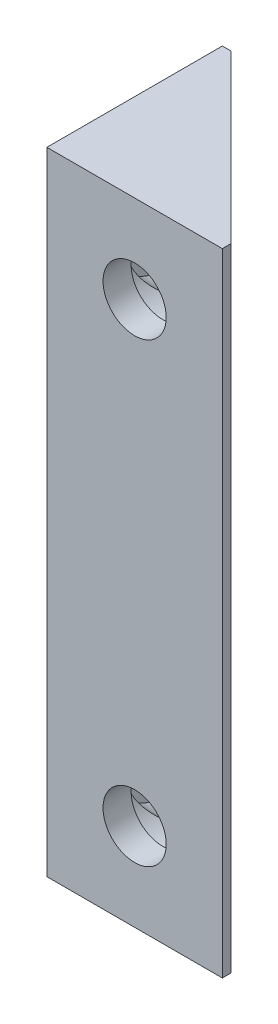
from build123d import *

# Parameters (mm, degrees)
BOSS_EXTRUDE1_DEPTH = 36
CUT_EXTRUDE1_REACH  = 47.782
SKETCH3_R           = 3.6
CUT_EXTRUDE3_REACH  = 50.982
CUT_EXTRUDE3_START  = -3.2
SKETCH3_4_R         = 5.5
SKETCH3_4_R_2       = 3.6
CUT_EXTRUDE2_REACH  = 47.782
SKETCH4_R           = 3.6
CUT_EXTRUDE4_REACH  = 50.982
CUT_EXTRUDE4_START  = -3.2
SKETCH4_3_R         = 5.5
SKETCH4_3_R_2       = 3.6


with BuildPart() as part:
    # Sketch2 → Boss-Extrude1 (new, symmetric)
    with BuildSketch(Plane(origin=(0, 0, 0), x_dir=(1, 0, 0), z_dir=(0, 1, 0))):
        Polygon((0, 0), (0, 20), (1, 20), (20, 1), (20, 0), align=None)
    extrude(amount=BOSS_EXTRUDE1_DEPTH, both=True)

    # Cut-Extrude1: up to this plane
    cut_extrude1_end = Plane(origin=(1, 36, -20), z_dir=(-0.7071067811865476, 0, 0.7071067811865476))
    # Sketch3 → Cut-Extrude1 (cut, up to the surface)
    with BuildSketch(Plane.XY, mode=Mode.PRIVATE) as cut_extrude1_sk1:
        with Locations((10, 26)):
            Circle(SKETCH3_R)
    cut_extrude1_tool1 = split(extrude(cut_extrude1_sk1.sketch, amount=-CUT_EXTRUDE1_REACH, mode=Mode.PRIVATE), bisect_by=cut_extrude1_end, keep=Keep.BOTH, mode=Mode.PRIVATE)
    add(cut_extrude1_tool1.solids().sort_by_distance((10, 26, 0))[0], mode=Mode.SUBTRACT)
    # Sketch3 → Cut-Extrude1 (cut, up to the surface)
    with BuildSketch(Plane.XY, mode=Mode.PRIVATE) as cut_extrude1_sk2:
        with Locations((10, -26)):
            Circle(SKETCH3_R)
    cut_extrude1_tool2 = split(extrude(cut_extrude1_sk2.sketch, amount=-CUT_EXTRUDE1_REACH, mode=Mode.PRIVATE), bisect_by=cut_extrude1_end, keep=Keep.BOTH, mode=Mode.PRIVATE)
    add(cut_extrude1_tool2.solids().sort_by_distance((10, -26, 0))[0], mode=Mode.SUBTRACT)

    # Cut-Extrude3: up to this plane
    cut_extrude3_end = Plane(origin=(1, 36, -20), z_dir=(-0.7071067811865476, 0, 0.7071067811865476))
    # Sketch3<4> → Cut-Extrude3 (cut, up to the surface)
    with BuildSketch(Plane.XY.offset(CUT_EXTRUDE3_START), mode=Mode.PRIVATE) as cut_extrude3_sk1:
        with Locations((10, 26)):
            Circle(SKETCH3_4_R)
        with Locations((10, 26)):
            Circle(SKETCH3_4_R_2, mode=Mode.SUBTRACT)
    cut_extrude3_tool1 = split(extrude(cut_extrude3_sk1.sketch, amount=-CUT_EXTRUDE3_REACH, mode=Mode.PRIVATE), bisect_by=cut_extrude3_end, keep=Keep.BOTH, mode=Mode.PRIVATE)
    add(cut_extrude3_tool1.solids().sort_by_distance((4.655563, 26, -3.2))[0], mode=Mode.SUBTRACT)
    # Sketch3<4> → Cut-Extrude3 (cut, up to the surface)
    with BuildSketch(Plane.XY.offset(CUT_EXTRUDE3_START), mode=Mode.PRIVATE) as cut_extrude3_sk2:
        with Locations((10, -26)):
            Circle(SKETCH3_4_R)
        with Locations((10, -26)):
            Circle(SKETCH3_4_R_2, mode=Mode.SUBTRACT)
    cut_extrude3_tool2 = split(extrude(cut_extrude3_sk2.sketch, amount=-CUT_EXTRUDE3_REACH, mode=Mode.PRIVATE), bisect_by=cut_extrude3_end, keep=Keep.BOTH, mode=Mode.PRIVATE)
    add(cut_extrude3_tool2.solids().sort_by_distance((4.655563, -26, -3.2))[0], mode=Mode.SUBTRACT)

    # Cut-Extrude2: up to this plane
    cut_extrude2_end = Plane(origin=(1, 36, -20), z_dir=(-0.7071067811865476, 0, 0.7071067811865476))
    # Sketch4 → Cut-Extrude2 (cut, up to the surface)
    with BuildSketch(Plane.ZY, mode=Mode.PRIVATE) as cut_extrude2_sk1:
        with Locations((-10, 26)):
            Circle(SKETCH4_R)
    cut_extrude2_tool1 = split(extrude(cut_extrude2_sk1.sketch, amount=-CUT_EXTRUDE2_REACH, mode=Mode.PRIVATE), bisect_by=cut_extrude2_end, keep=Keep.BOTH, mode=Mode.PRIVATE)
    add(cut_extrude2_tool1.solids().sort_by_distance((0, 26, -10))[0], mode=Mode.SUBTRACT)
    # Sketch4 → Cut-Extrude2 (cut, up to the surface)
    with BuildSketch(Plane.ZY, mode=Mode.PRIVATE) as cut_extrude2_sk2:
        with Locations((-10, -26)):
            Circle(SKETCH4_R)
    cut_extrude2_tool2 = split(extrude(cut_extrude2_sk2.sketch, amount=-CUT_EXTRUDE2_REACH, mode=Mode.PRIVATE), bisect_by=cut_extrude2_end, keep=Keep.BOTH, mode=Mode.PRIVATE)
    add(cut_extrude2_tool2.solids().sort_by_distance((0, -26, -10))[0], mode=Mode.SUBTRACT)

    # Cut-Extrude4: up to this plane
    cut_extrude4_end = Plane(origin=(1, 36, -20), z_dir=(-0.7071067811865476, 0, 0.7071067811865476))
    # Sketch4<3> → Cut-Extrude4 (cut, up to the surface)
    with BuildSketch(Plane.ZY.offset(CUT_EXTRUDE4_START), mode=Mode.PRIVATE) as cut_extrude4_sk1:
        with Locations((-10, 26)):
            Circle(SKETCH4_3_R)
        with Locations((-10, 26)):
            Circle(SKETCH4_3_R_2, mode=Mode.SUBTRACT)
    cut_extrude4_tool1 = split(extrude(cut_extrude4_sk1.sketch, amount=-CUT_EXTRUDE4_REACH, mode=Mode.PRIVATE), bisect_by=cut_extrude4_end, keep=Keep.BOTH, mode=Mode.PRIVATE)
    add(cut_extrude4_tool1.solids().sort_by_distance((3.2, 26, -15.344437))[0], mode=Mode.SUBTRACT)
    # Sketch4<3> → Cut-Extrude4 (cut, up to the surface)
    with BuildSketch(Plane.ZY.offset(CUT_EXTRUDE4_START), mode=Mode.PRIVATE) as cut_extrude4_sk2:
        with Locations((-10, -26)):
            Circle(SKETCH4_3_R)
        with Locations((-10, -26)):
            Circle(SKETCH4_3_R_2, mode=Mode.SUBTRACT)
    cut_extrude4_tool2 = split(extrude(cut_extrude4_sk2.sketch, amount=-CUT_EXTRUDE4_REACH, mode=Mode.PRIVATE), bisect_by=cut_extrude4_end, keep=Keep.BOTH, mode=Mode.PRIVATE)
    add(cut_extrude4_tool2.solids().sort_by_distance((3.2, -26, -15.344437))[0], mode=Mode.SUBTRACT)


solid = part.part
